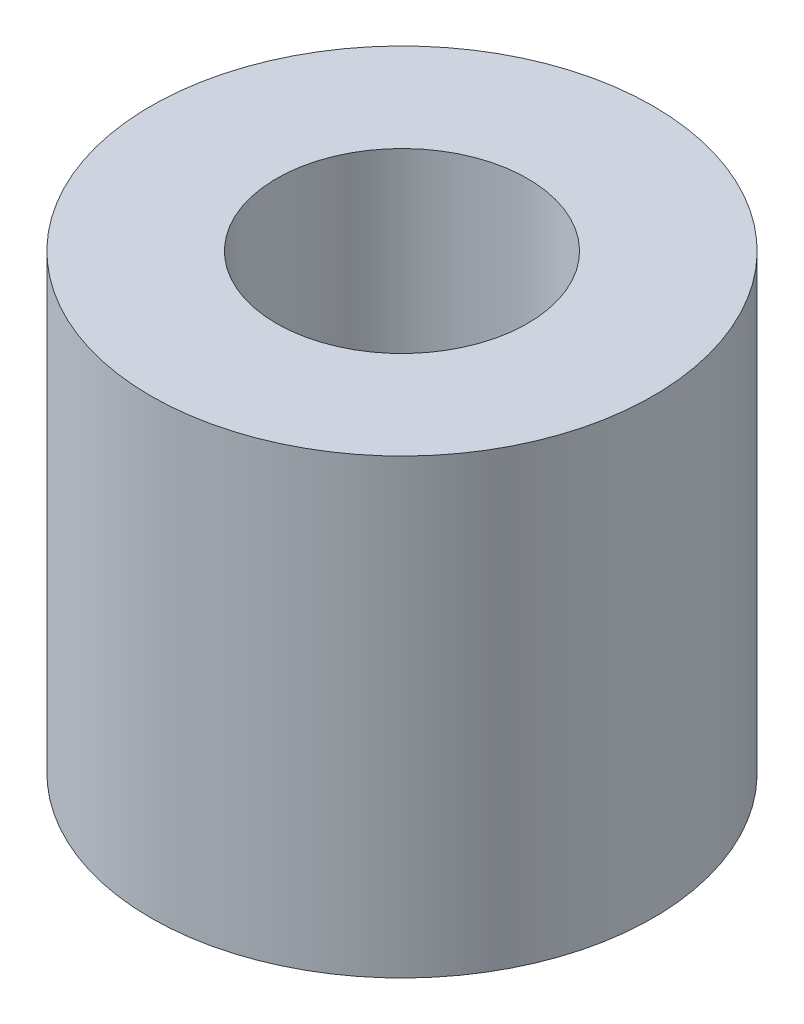
from build123d import *

# Parameters (mm, degrees)
SKETCH1_R           = 5
SKETCH1_R_2         = 2.5
BOSS_EXTRUDE1_DEPTH = 9


with BuildPart() as part:
    # Sketch1 → Boss-Extrude1 (new body)
    with BuildSketch(Plane(origin=(0, 0, 0), x_dir=(1, 0, 0), z_dir=(0, 1, 0))):
        with Locations(Location((0, 0, 0), (0, 0, 270))):
            Circle(SKETCH1_R)
        with Locations(Location((0, 0, 0), (0, 0, 270))):
            Circle(SKETCH1_R_2, mode=Mode.SUBTRACT)
    extrude(amount=BOSS_EXTRUDE1_DEPTH)


solid = part.part
